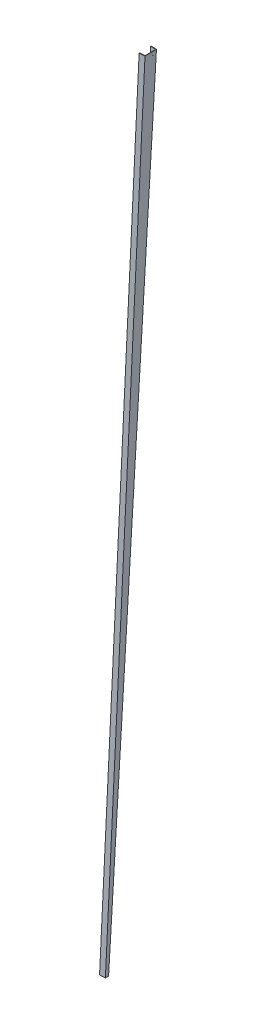
from build123d import *

# Parameters (mm, degrees)
BOSS_EXTRUDE1_DEPTH       = 6
BOSS_EXTRUDE2_DEPTH       = 6
F_4_0MM_DOWEL_HOLE1_D     = 4
F_4_0MM_DOWEL_HOLE1_DEPTH = 691.048650037


with BuildPart() as part:
    # Sketch1 → Boss-Extrude1 (new body)
    with BuildSketch(Plane(origin=(0, 0, 0), x_dir=(1, 0, 0), z_dir=(0, 1, 0))):
        with BuildLine():
            Line((2600, -170.586848035), (2600, 39.964081965))
            add(Edge.make_bspline(
                [(2500.052462015, 43.202855025), (2533.368165788, 42.118735422), (2566.684003357, 41.038906482), (2600, 39.964081965)],
                knots=[0.814310206, 0.814310206, 0.814310206, 0.814310206, 0.826684648, 0.826684648, 0.826684648, 0.826684648], degree=3))
            Line((2500.052462015, 43.202855025), (2499.792273349, 35.207087279))
            Line((2499.792273349, 35.207087279), (2596, 32.093533273))
            Line((2596, 32.093533273), (2596, -162.925321623))
            Line((2596, -162.925321623), (2499.703486598, -171.073778237))
            Line((2499.703486598, -171.073778237), (2500.358506507, -179.04691745))
            add(Edge.make_bspline(
                [(2600, -170.586848035), (2566.793832387, -173.496724848), (2533.579916888, -176.317668077), (2500.358506507, -179.04691745)],
                knots=[0.174597884, 0.174597884, 0.174597884, 0.174597884, 0.186972113, 0.186972113, 0.186972113, 0.186972113], degree=3))
        make_face()
    extrude(amount=-BOSS_EXTRUDE1_DEPTH)



with BuildPart() as body_2:
    # Sketch2 → Boss-Extrude2 (new body)
    with BuildSketch(Plane(origin=(0, -15000, 0), x_dir=(1, 0, 0), z_dir=(0, 1, 0))):
        with BuildLine():
            Line((1912.5, -210.580889388), (1912.5, -151.658724384))
            add(Edge.make_bspline(
                [(1812.553229164, -148.39636335), (1824.752172678, -148.79613245), (1858.06748925, -149.892488396), (1891.3831508, -150.977462842), (1912.5, -151.658724384)],
                knots=[0.787086448, 0.787086448, 0.787086448, 0.787086448, 0.801585908, 0.826684648, 0.826684648, 0.826684648, 0.826684648], degree=3))
            Line((1812.553229164, -148.39636335), (1812.291203449, -156.392071106))
            Line((1812.291203449, -156.392071106), (1908.5, -159.528330511))
            Line((1908.5, -159.528330511), (1908.5, -202.894849438))
            Line((1908.5, -202.894849438), (1812.252662355, -210.449304162))
            Line((1812.252662355, -210.449304162), (1812.808516239, -218.429969952))
            add(Edge.make_bspline(
                [(1912.5, -210.580889388), (1891.959282547, -212.380885064), (1858.737335883, -215.114757805), (1825.492197957, -217.546550706), (1812.808516239, -218.429969952)],
                knots=[0.174597884, 0.174597884, 0.174597884, 0.174597884, 0.199092181, 0.214195944, 0.214195944, 0.214195944, 0.214195944], degree=3))
        make_face()
    extrude(amount=BOSS_EXTRUDE2_DEPTH)


with BuildPart() as part_1:
    add(part.part)

    add(body_2.part)  # loft1 joins it to this body
    # loft from a face of the part (loft1)
    loft([part_1.faces().sort_by_distance((2549.978703163, -6, 172.455031752))[0], part_1.faces().sort_by_distance((1862.575784766, -14994, 213.50968439))[0]])

    # Ø4.0mm Dowel Hole1
    with Locations(Plane(origin=(2592.577472154, -80.613597565, -62.953690956), x_dir=(-0.04582184873701848, -0.9989496274479118, 0), z_dir=(-0.9989496274479118, 0.04582184873701848, 0))):
        with Locations((-14.692264944, 128.529423621), (-14.69226494, 208.529423621), (-14.692264942, 168.529423621), (-14.692264948, 48.529423621), (-14.692264946, 88.529423621)):
            Hole(F_4_0MM_DOWEL_HOLE1_D / 2, depth=F_4_0MM_DOWEL_HOLE1_DEPTH)


solid = part_1.part
